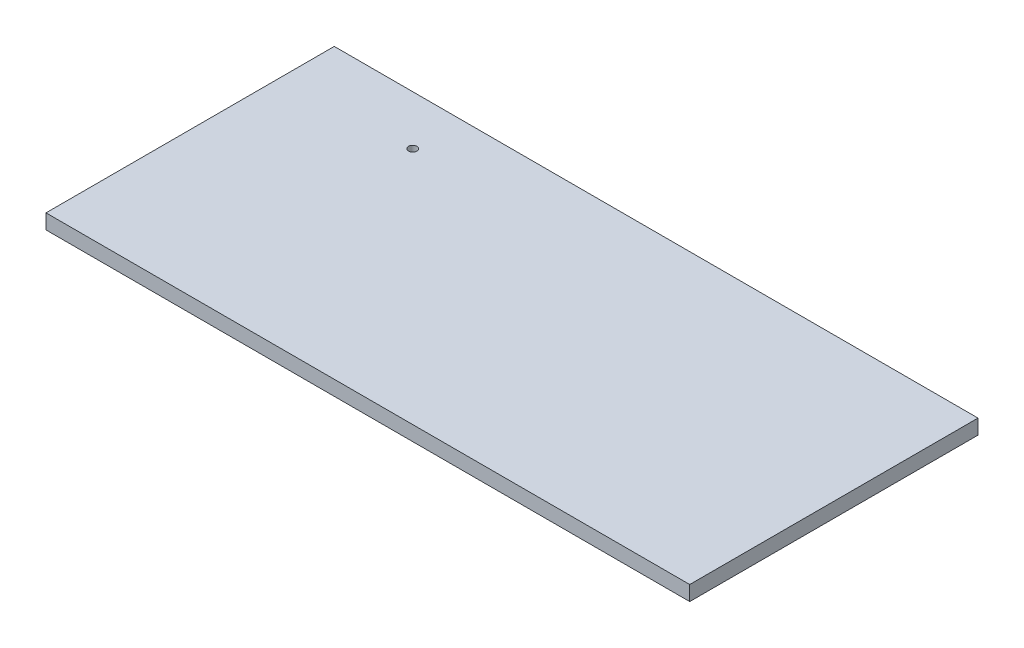
from build123d import *

# Parameters (mm, degrees)
SKETCH1_W           = 130.41
SKETCH1_H           = 58.4
BOSS_EXTRUDE1_DEPTH = 3
SKETCH3_R           = 0.85
CUT_EXTRUDE1_DEPTH  = 143.920705638


with BuildPart() as part:
    # Sketch1 → Boss-Extrude1 (new body)
    with BuildSketch(Plane(origin=(0, 0, 0), x_dir=(1, 0, 0), z_dir=(0, 1, 0))):
        with Locations((65.205, -29.2)):
            Rectangle(SKETCH1_W, SKETCH1_H)
    extrude(amount=BOSS_EXTRUDE1_DEPTH)

    # Sketch3 → Cut-Extrude1 (cut, through all)
    with BuildSketch(Plane(origin=(0, 3, 0), x_dir=(1, 0, 0), z_dir=(0, 1, 0))):
        with Locations(Location((25.89, -10, 0), (0, 0, 270))):
            Circle(SKETCH3_R)
    extrude(amount=-CUT_EXTRUDE1_DEPTH, mode=Mode.SUBTRACT)


solid = part.part
